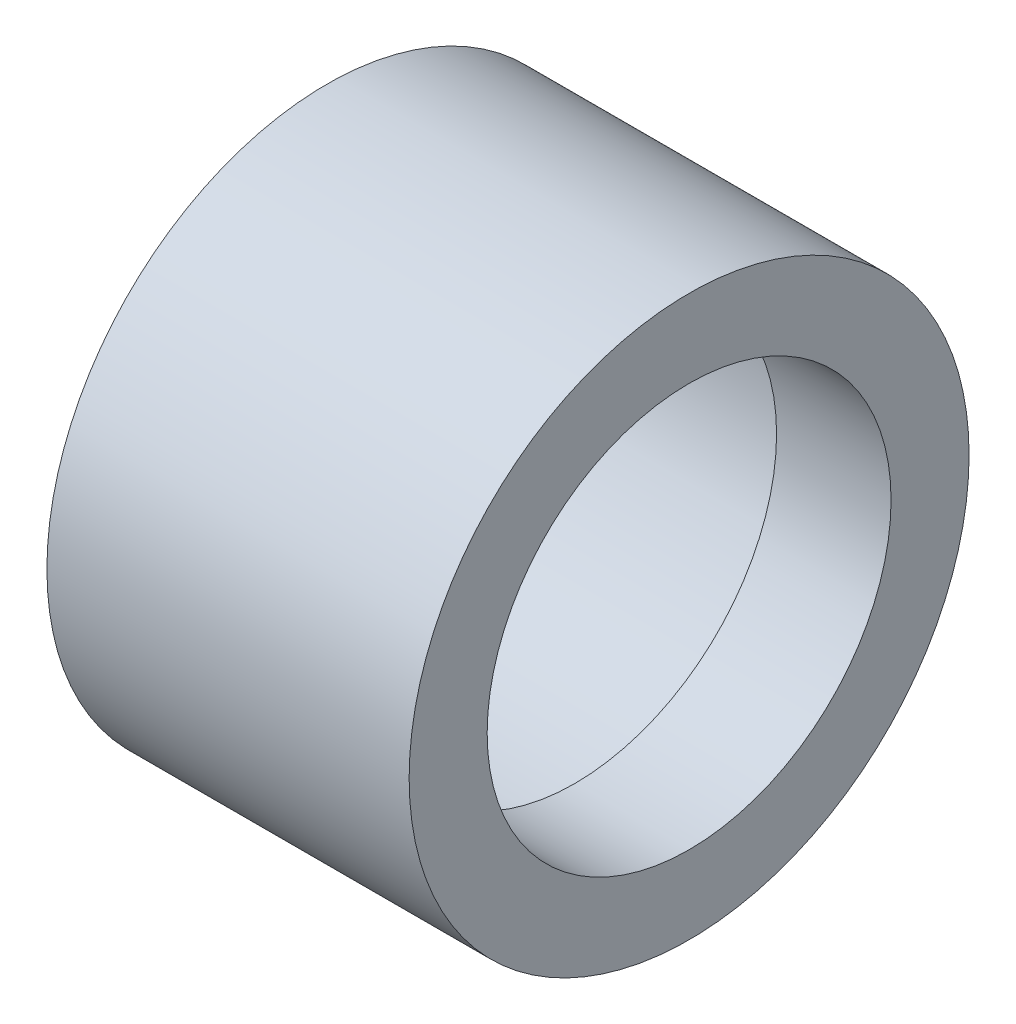
from build123d import *

# Parameters (mm, degrees)
SKETCH14_R           = 30.5
BOSS_EXTRUDE11_DEPTH = 39.4589
SKETCH15_R           = 22
CUT_EXTRUDE2_DEPTH   = 59.459428574
SKETCH13_R           = 26.9875
CUT_EXTRUDE3_DEPTH   = 26.9875


with BuildPart() as part:
    # Sketch14 → Boss-Extrude11 (new body)
    with BuildSketch(Plane(origin=(0, 0, 0), x_dir=(0, 0, -1), z_dir=(1, 0, 0))):
        Circle(SKETCH14_R)
    extrude(amount=BOSS_EXTRUDE11_DEPTH)

    # Sketch15 → Cut-Extrude2 (cut, through all)
    with BuildSketch(Plane.ZY):
        Circle(SKETCH15_R)
    extrude(amount=-CUT_EXTRUDE2_DEPTH, mode=Mode.SUBTRACT)

    # Sketch13 → Cut-Extrude3 (cut)
    with BuildSketch(Plane.ZY):
        Circle(SKETCH13_R)
    extrude(amount=-CUT_EXTRUDE3_DEPTH, mode=Mode.SUBTRACT)


solid = part.part
